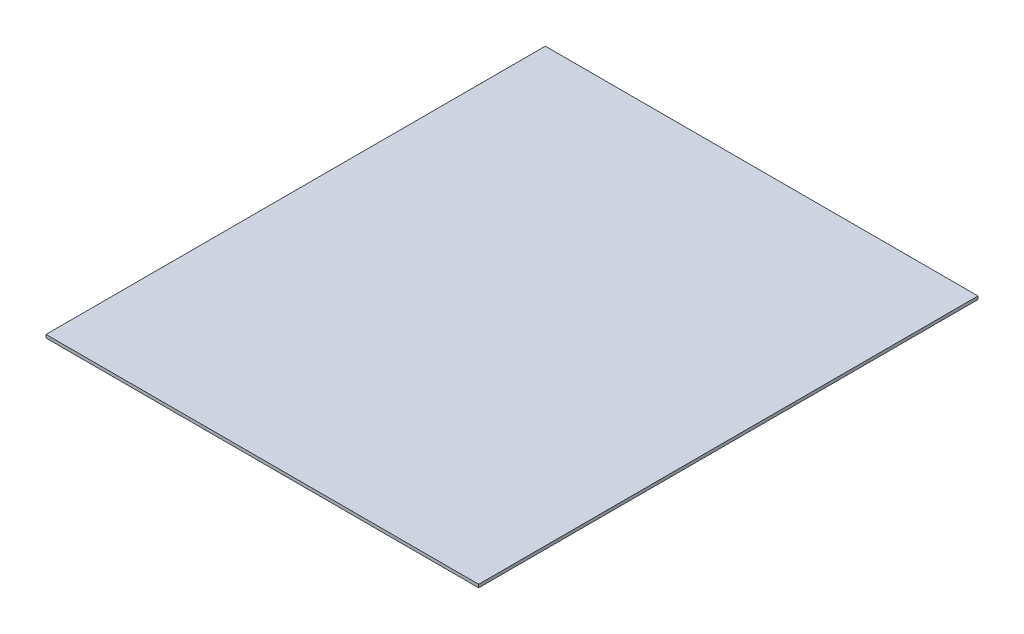
from build123d import *

# Parameters (mm, degrees)
SKETCH1_W  = 277.3
SKETCH1_H  = 320
BASE_DEPTH = 2


with BuildPart() as part:
    # Sketch1 → Base (new body)
    with BuildSketch(Plane(origin=(0, 0, 0), x_dir=(1, 0, 0), z_dir=(0, 1, 0))):
        Rectangle(SKETCH1_W, SKETCH1_H)
    extrude(amount=BASE_DEPTH)


solid = part.part
